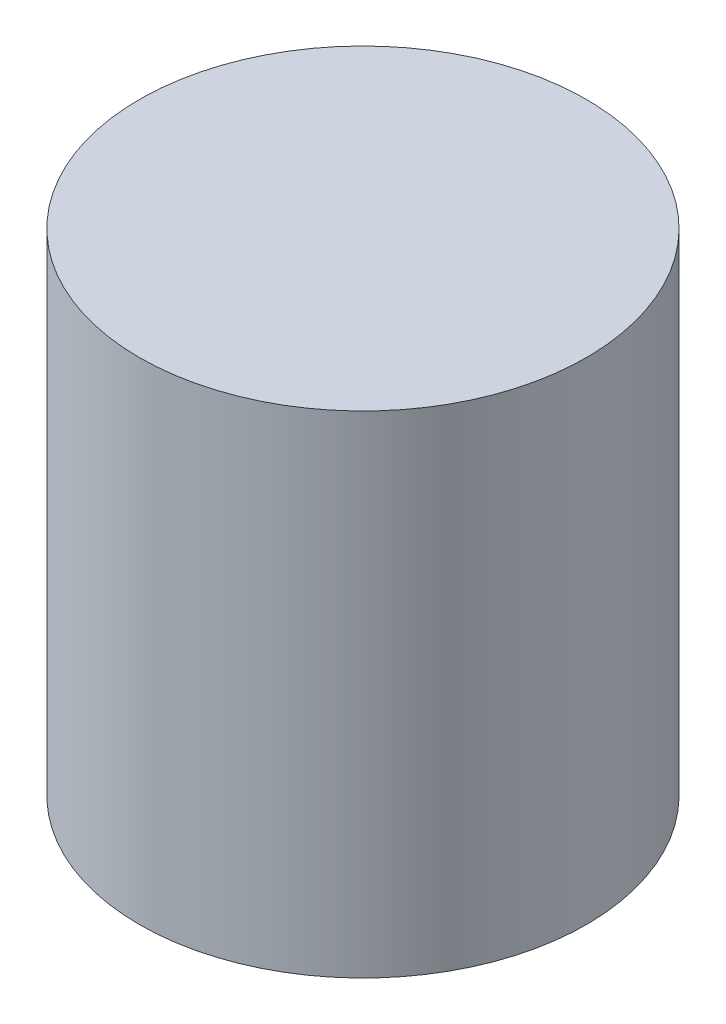
from build123d import *

# Parameters (mm, degrees)
SKETCH2_R           = 1.27
BOSS_EXTRUDE1_DEPTH = 2.79
SKETCH3_R           = 1
CUT_EXTRUDE1_DEPTH  = 1.5


with BuildPart() as part:
    # Sketch2 → Boss-Extrude1 (new body)
    with BuildSketch(Plane(origin=(0, 0, 0), x_dir=(1, 0, 0), z_dir=(0, 1, 0))):
        with Locations(Location((-33.84086576, 9.813636364, 0), (0, 0, 270))):
            Circle(SKETCH2_R)
    extrude(amount=BOSS_EXTRUDE1_DEPTH)

    # Sketch3 → Cut-Extrude1 (cut)
    with BuildSketch(Plane.XZ):
        with Locations(Location((-33.84086576, -9.813636364, 0), (0, 0, 270))):
            Circle(SKETCH3_R)
    extrude(amount=-CUT_EXTRUDE1_DEPTH, mode=Mode.SUBTRACT)


solid = part.part
